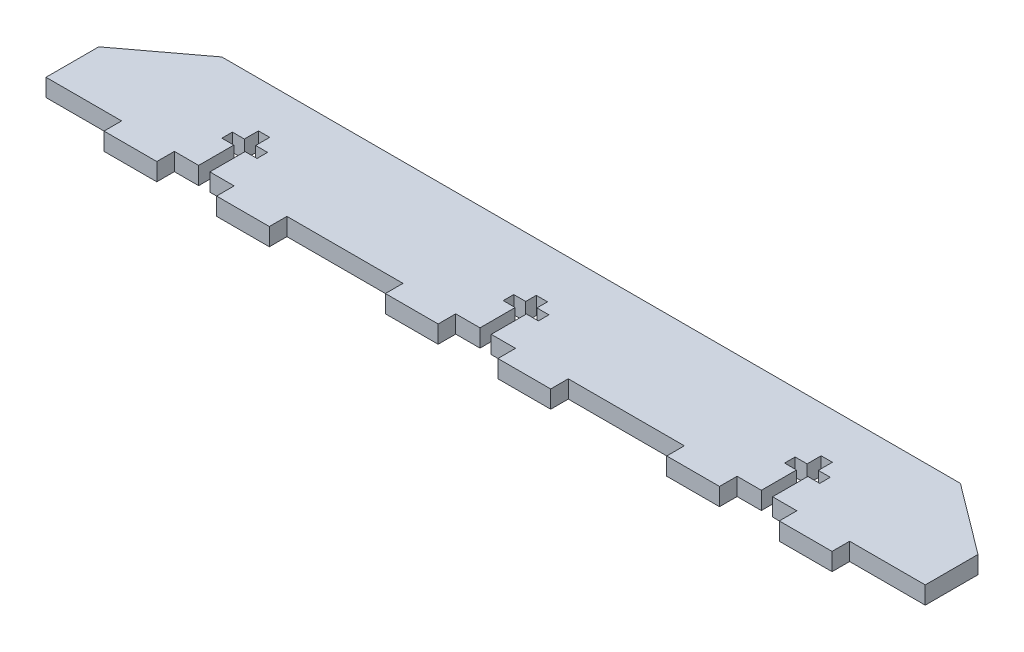
from build123d import *

# Parameters (mm, degrees)
EXTRUDE_1_DEPTH = 5


with BuildPart() as part:
    # 草圖1 → 填料-伸長1 (new body)
    with BuildSketch(Plane(origin=(0, 0, 0), x_dir=(1, 0, 0), z_dir=(0, 1, 0))):
        Polygon((-125, -15), (-103.5, -15), (-103.5, -20), (-88.5, -20), (-88.5, -15), (-81.6, -15), (-81.6, -5), (-85, -5), (-85, -2), (-81.6, -2), (-81.6, 2), (-78.4, 2), (-78.4, -2), (-75, -2), (-75, -5), (-78.4, -5), (-78.4, -15), (-71.5, -15), (-71.5, -20), (-56.5, -20), (-56.5, -15), (-23.5, -15), (-23.5, -20), (-8.5, -20), (-8.5, -15), (-1.6, -15), (-1.6, -5), (-5, -5), (-5, -2), (-1.6, -2), (-1.6, 1), (1.6, 1), (1.6, -2), (5, -2), (5, -5), (1.6, -5), (1.6, -15), (8.5, -15), (8.5, -20), (23.5, -20), (23.5, -15), (56.5, -15), (56.5, -20), (71.5, -20), (71.5, -15), (78.4, -15), (78.4, -5), (75, -5), (75, -2), (78.4, -2), (78.4, 2), (81.6, 2), (81.6, -2), (85, -2), (85, -5), (81.6, -5), (81.6, -15), (88.5, -15), (88.5, -20), (103.5, -20), (103.5, -15), (125, -15), (125, 0), (105, 15), (-105, 15), (-125, 0), align=None)
    extrude(amount=EXTRUDE_1_DEPTH)


solid = part.part
